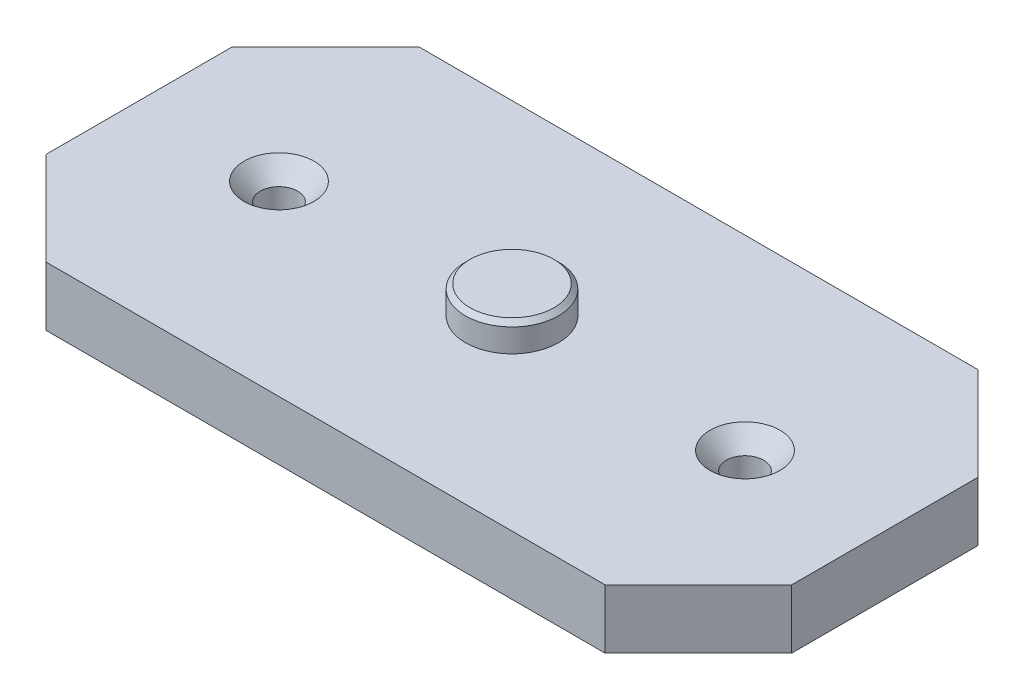
from build123d import *

# Parameters (mm, degrees)
SKETCH1_W                                       = 80
SKETCH1_H                                       = 40
BOSS_EXTRUDE1_DEPTH                             = 6.35
CSK_FOR_M3_FLAT_HEAD_MACHINE_SCREW1_D           = 4
CSK_FOR_M3_FLAT_HEAD_MACHINE_SCREW1_CSINK_D     = 7.5
CSK_FOR_M3_FLAT_HEAD_MACHINE_SCREW1_CSINK_ANGLE = 85
BOSS_EXTRUDE2_DEPTH                             = 3
BOSS_EXTRUDE2_DEPTH_BACK                        = 15
SKETCH8_R                                       = 5
CHAMFER1_SIZE                                   = 10
CHAMFER2_SIZE                                   = 0.5


with BuildPart() as part:
    # Sketch1 → Boss-Extrude1 (new body)
    with BuildSketch(Plane(origin=(0, 0, 0), x_dir=(1, 0, 0), z_dir=(0, 1, 0))):
        Rectangle(SKETCH1_W, SKETCH1_H)
    extrude(amount=BOSS_EXTRUDE1_DEPTH)

    # CSK for M3 Flat Head Machine Screw1 (through all)
    with Locations(Plane(origin=(0, 6.35, 0), x_dir=(1, 0, 0), z_dir=(0, 1, 0))):
        with Locations((-25, 0), (25, 0)):
            CounterSinkHole(CSK_FOR_M3_FLAT_HEAD_MACHINE_SCREW1_D / 2, CSK_FOR_M3_FLAT_HEAD_MACHINE_SCREW1_CSINK_D / 2, counter_sink_angle=CSK_FOR_M3_FLAT_HEAD_MACHINE_SCREW1_CSINK_ANGLE)

    # Sketch8 → Boss-Extrude2 (add, two sides: drawn at the far end of the back side and taken through both)
    with BuildSketch(Plane(origin=(0, 6.35, 0), x_dir=(1, 0, 0), z_dir=(0, 1, 0)).offset(-BOSS_EXTRUDE2_DEPTH_BACK)):
        with Locations(Location((0, 0, 0), (0, 0, 270))):
            Circle(SKETCH8_R)
    extrude(amount=BOSS_EXTRUDE2_DEPTH + BOSS_EXTRUDE2_DEPTH_BACK)

    # Chamfer1
    chamfer1_edges = [part.edges().sort_by_distance(p)[0] for p in [
        (40, 3.175, 20),
        (-40, 3.175, 20),
        (-40, 3.175, -20),
        (40, 3.175, -20),
    ]]
    chamfer(chamfer1_edges, length=CHAMFER1_SIZE)

    # Chamfer2
    chamfer2_edges = [part.edges().sort_by_distance(p)[0] for p in [
        (0, -8.65, -5),
        (0, 9.35, -5),
    ]]
    chamfer(chamfer2_edges, length=CHAMFER2_SIZE)


solid = part.part
